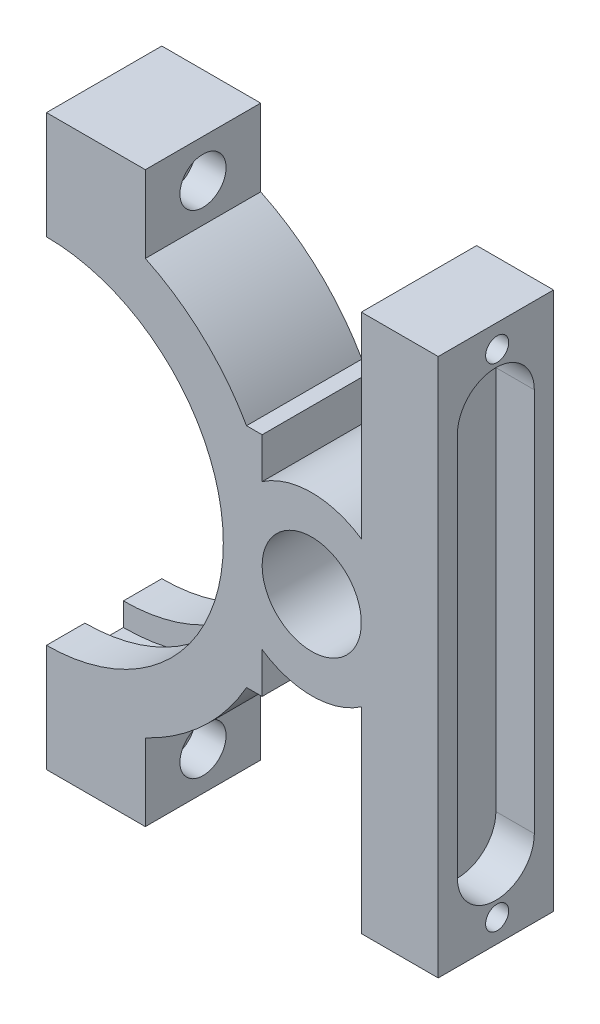
from build123d import *

# Parameters (mm, degrees)
SKETCH1_R               = 6.45
BOSS_EXTRUDE1_DEPTH     = 15
SKETCH2_W               = 5
SKETCH2_H               = 3
CUT_EXTRUDE3_DEPTH      = 5
CUT_EXTRUDE4_DEPTH      = 56.180796325
CUT_EXTRUDE4_DEPTH_BACK = 56.180796325
SKETCH4_R               = 1.5
SKETCH5_R               = 3
CUT_EXTRUDE5_DEPTH      = 4


with BuildPart() as part:
    # Sketch1 → Boss-Extrude1 (new body)
    with BuildSketch(Plane.XY):
        with BuildLine():
            Line((0, 23), (0, 37))
            Line((0, 37), (12.859510911, 37))
            Line((12.859510911, 37), (12.859510911, 27))
            ThreePointArc((12.859510911, 27), (20.383390121, 21.88342816), (26.020458433, 14.741192754))
            Line((26.020458433, 14.741192754), (28.050458433, 14.741192754))
            Line((28.050458433, 14.741192754), (28.050458433, 9.460443964))
            ThreePointArc((28.050458433, 9.460443964), (34.500458433, 11.45), (40.950458433, 9.460443964))
            Line((40.950458433, 9.460443964), (40.950458433, 35))
            Line((40.950458433, 35), (50.950458433, 35))
            Line((50.950458433, 35), (50.950458433, -35))
            Line((50.950458433, -35), (40.950458433, -35))
            Line((40.950458433, -35), (40.950458433, -9.460443964))
            ThreePointArc((40.950458433, -9.460443964), (34.500458433, -11.45), (28.050458433, -9.460443964))
            Line((28.050458433, -9.460443964), (28.050458433, -14.741192754))
            Line((28.050458433, -14.741192754), (26.020458433, -14.741192754))
            ThreePointArc((26.020458433, -14.741192754), (20.383390121, -21.88342816), (12.859510911, -27))
            Line((12.859510911, -27), (12.859510911, -37))
            Line((12.859510911, -37), (0, -37))
            Line((0, -37), (0, -23))
            ThreePointArc((0, -23), (23, 0), (0, 23))
        make_face()
        with Locations(Location((34.500458433, 0, 0), (0, 0, 180))):
            Circle(SKETCH1_R, mode=Mode.SUBTRACT)
    extrude(amount=BOSS_EXTRUDE1_DEPTH)

    # Sketch2 → Cut-Revolve1 (revolve, cut)
    with BuildSketch(Plane.ZY):
        with Locations((7.5, 24.5)):
            Rectangle(SKETCH2_W, SKETCH2_H)
    revolve(axis=Axis((0, 0, 15), (0, 0, -1)), mode=Mode.SUBTRACT)

    # Sketch3 → Cut-Extrude3 (cut)
    with BuildSketch(Plane(origin=(50.950458433, 0, 0), x_dir=(0, 0, -1), z_dir=(1, 0, 0))):
        with BuildLine():
            Line((-12.5, -25), (-12.5, 25))
            ThreePointArc((-12.5, 25), (-7.5, 30), (-2.5, 25))
            Line((-2.5, 25), (-2.5, -25))
            ThreePointArc((-2.5, -25), (-7.5, -30), (-12.5, -25))
        make_face()
    extrude(amount=-CUT_EXTRUDE3_DEPTH, mode=Mode.SUBTRACT)

    # Sketch4 → Cut-Extrude4 (cut, two sides: drawn at the far end of the back side and taken through both)
    with BuildSketch(Plane(origin=(12.859510911, 0, 0), x_dir=(0, 0, -1), z_dir=(1, 0, 0)).offset(-CUT_EXTRUDE4_DEPTH_BACK)):
        with Locations((-7.333431897, 32)):
            Circle(SKETCH4_R)
        with Locations((-7.333431897, -32)):
            Circle(SKETCH4_R)
    extrude(amount=CUT_EXTRUDE4_DEPTH + CUT_EXTRUDE4_DEPTH_BACK, mode=Mode.SUBTRACT)

    # Sketch5 → Cut-Extrude5 (cut)
    with BuildSketch(Plane(origin=(12.859510911, 0, 0), x_dir=(0, 0, -1), z_dir=(1, 0, 0))):
        with Locations((-7.5, 32)):
            Circle(SKETCH5_R)
        with Locations(Location((-7.5, -32, 0), (0, 0, 180))):
            Circle(SKETCH5_R)
    extrude(amount=-CUT_EXTRUDE5_DEPTH, mode=Mode.SUBTRACT)


solid = part.part
